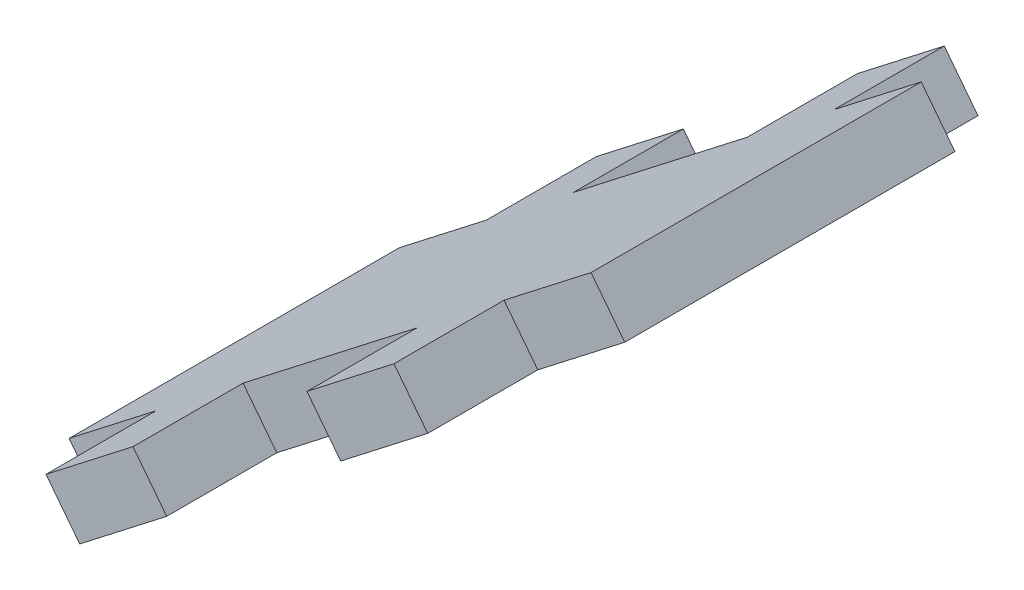
from build123d import *

# Parameters (mm, degrees)
BOSS_EXTRUDE1_DEPTH = 31.75
SKETCH2_W           = 6.35
SKETCH2_H           = 6.35
SKETCH2_W_2         = 12.7
CUT_EXTRUDE1_DEPTH  = 111.8787522


with BuildPart() as part:
    # Sketch1 → Boss-Extrude1 (new body)
    with BuildSketch(Plane.XY):
        Polygon((-134.342603935, 282.007686167), (-136.287750881, 284.517074212), (-106.175094345, 307.858837563), (-104.229947399, 305.349449518), align=None)
    extrude(amount=-BOSS_EXTRUDE1_DEPTH)

    # Sketch2 → Cut-Extrude1 (cut, through all)
    with BuildSketch(Plane(origin=(-188.919067382, 243.720018226, 0), x_dir=(0.7903584392757801, 0.6126447073676171, 0), z_dir=(-0.612644707367617, 0.79035843927578, 0))):
        with Locations((69.766705593, 28.575)):
            Rectangle(SKETCH2_W, SKETCH2_H)
        with Locations((101.516705593, 28.575)):
            Rectangle(SKETCH2_W, SKETCH2_H)
        with Locations((85.641705593, 28.575)):
            Rectangle(SKETCH2_W_2, SKETCH2_H)
        with Locations((69.766705593, 3.175)):
            Rectangle(SKETCH2_W, SKETCH2_H)
        with Locations((85.641705593, 3.175)):
            Rectangle(SKETCH2_W_2, SKETCH2_H)
        with Locations((101.516705593, 3.175)):
            Rectangle(SKETCH2_W, SKETCH2_H)
    extrude(amount=-CUT_EXTRUDE1_DEPTH, mode=Mode.SUBTRACT)


solid = part.part
